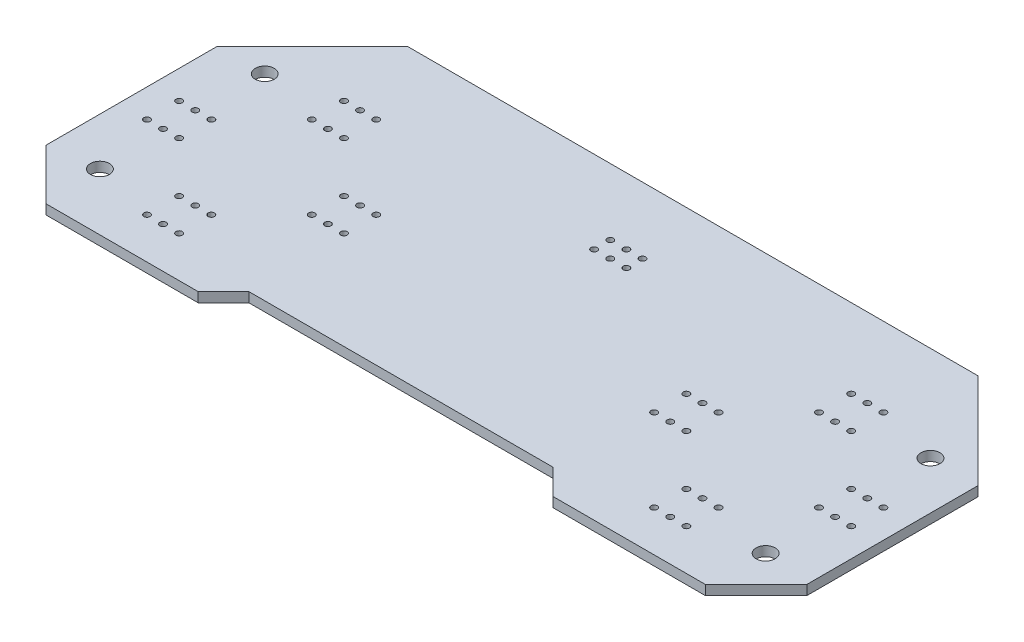
from build123d import *

# Parameters (mm, degrees)
SKETCH1_W           = 120
SKETCH1_H           = 50
SKETCH1_R           = 1.5
BOSS_EXTRUDE1_DEPTH = 1.53
SKETCH2_R           = 0.5
CUT_EXTRUDE1_DEPTH  = 67.229456437
SKETCH5_R           = 0.5
CUT_EXTRUDE2_DEPTH  = 67.229456437
SKETCH6_W           = 141.050966046
SKETCH6_H           = 69.53153639
CUT_EXTRUDE4_DEPTH  = 67.229456437


with BuildPart() as part:
    # Sketch1 → Boss-Extrude1 (new body)
    with BuildSketch(Plane(origin=(0, 0, 0), x_dir=(1, 0, 0), z_dir=(0, 1, 0))):
        with Locations((0, 3)):
            Rectangle(SKETCH1_W, SKETCH1_H)
        with Locations(Location((52.5, 13, 0), (0, 0, 270))):
            Circle(SKETCH1_R, mode=Mode.SUBTRACT)
        with Locations(Location((52.5, -13, 0), (0, 0, 270))):
            Circle(SKETCH1_R, mode=Mode.SUBTRACT)
        with Locations(Location((-52.5, -13, 0), (0, 0, 270))):
            Circle(SKETCH1_R, mode=Mode.SUBTRACT)
        with Locations(Location((-52.5, 13, 0), (0, 0, 270))):
            Circle(SKETCH1_R, mode=Mode.SUBTRACT)
    extrude(amount=BOSS_EXTRUDE1_DEPTH)

    # Sketch2 → Cut-Extrude1 (cut, through all)
    with BuildSketch(Plane(origin=(0, 1.53, 0), x_dir=(1, 0, 0), z_dir=(0, 1, 0))):
        with Locations(Location((-55.54, 2.54, 0), (0, 0, 270))):
            Circle(SKETCH2_R)
        with Locations(Location((-53, 2.54, 0), (0, 0, 270))):
            Circle(SKETCH2_R)
        with Locations(Location((-50.46, 2.54, 0), (0, 0, 270))):
            Circle(SKETCH2_R)
        with Locations(Location((-55.54, -2.54, 0), (0, 0, 270))):
            Circle(SKETCH2_R)
        with Locations(Location((-53, -2.54, 0), (0, 0, 270))):
            Circle(SKETCH2_R)
        with Locations(Location((-50.46, -2.54, 0), (0, 0, 270))):
            Circle(SKETCH2_R)
        with Locations(Location((-29.54, 2.54, 0), (0, 0, 270))):
            Circle(SKETCH2_R)
        with Locations(Location((-27, 2.54, 0), (0, 0, 270))):
            Circle(SKETCH2_R)
        with Locations(Location((-24.46, 2.54, 0), (0, 0, 270))):
            Circle(SKETCH2_R)
        with Locations(Location((-29.54, -2.54, 0), (0, 0, 270))):
            Circle(SKETCH2_R)
        with Locations(Location((-27, -2.54, 0), (0, 0, 270))):
            Circle(SKETCH2_R)
        with Locations(Location((-24.46, -2.54, 0), (0, 0, 270))):
            Circle(SKETCH2_R)
        with Locations(Location((-42.54, 15.54, 0), (0, 0, 270))):
            Circle(SKETCH2_R)
        with Locations(Location((-40, 15.54, 0), (0, 0, 270))):
            Circle(SKETCH2_R)
        with Locations(Location((-37.46, 15.54, 0), (0, 0, 270))):
            Circle(SKETCH2_R)
        with Locations(Location((-42.54, 10.46, 0), (0, 0, 270))):
            Circle(SKETCH2_R)
        with Locations(Location((-40, 10.46, 0), (0, 0, 270))):
            Circle(SKETCH2_R)
        with Locations(Location((-37.46, 10.46, 0), (0, 0, 270))):
            Circle(SKETCH2_R)
        with Locations(Location((-42.54, -10.46, 0), (0, 0, 270))):
            Circle(SKETCH2_R)
        with Locations(Location((-40, -10.46, 0), (0, 0, 270))):
            Circle(SKETCH2_R)
        with Locations(Location((-37.46, -10.46, 0), (0, 0, 270))):
            Circle(SKETCH2_R)
        with Locations(Location((-42.54, -15.54, 0), (0, 0, 270))):
            Circle(SKETCH2_R)
        with Locations(Location((-40, -15.54, 0), (0, 0, 270))):
            Circle(SKETCH2_R)
        with Locations(Location((-37.46, -15.54, 0), (0, 0, 270))):
            Circle(SKETCH2_R)
    cut_extrude1 = extrude(amount=-CUT_EXTRUDE1_DEPTH, mode=Mode.SUBTRACT)

    # Mirror1: Cut-Extrude1 across plane
    add(cut_extrude1.mirror(Plane(origin=(0, 0, 0), x_dir=(0, 0, 1), z_dir=(1, 0, 0))), mode=Mode.SUBTRACT)

    # Sketch5 → Cut-Extrude2 (cut, through all)
    with BuildSketch(Plane(origin=(0, 1.53, 0), x_dir=(1, 0, 0), z_dir=(0, 1, 0))):
        with Locations(Location((-2.54, 17.54, 0), (0, 0, 270))):
            Circle(SKETCH5_R)
        with Locations(Location((0, 17.54, 0), (0, 0, 270))):
            Circle(SKETCH5_R)
        with Locations(Location((2.54, 17.54, 0), (0, 0, 270))):
            Circle(SKETCH5_R)
        with Locations(Location((-2.54, 15, 0), (0, 0, 270))):
            Circle(SKETCH5_R)
        with Locations(Location((0, 15, 0), (0, 0, 270))):
            Circle(SKETCH5_R)
        with Locations(Location((2.54, 15, 0), (0, 0, 270))):
            Circle(SKETCH5_R)
    extrude(amount=-CUT_EXTRUDE2_DEPTH, mode=Mode.SUBTRACT)

    # Sketch6 → Cut-Extrude4 (cut, through all)
    with BuildSketch(Plane(origin=(0, 1.53, 0), x_dir=(1, 0, 0), z_dir=(0, 1, 0))):
        Rectangle(SKETCH6_W, SKETCH6_H)
        Polygon((-45, 28), (-60, 13), (-60, -14), (-52, -22), (-28, -22), (-24, -18), (24, -18), (28, -22), (52, -22), (60, -14), (60, 13), (45, 28), align=None, mode=Mode.SUBTRACT)
    extrude(amount=-CUT_EXTRUDE4_DEPTH, mode=Mode.SUBTRACT)


solid = part.part
